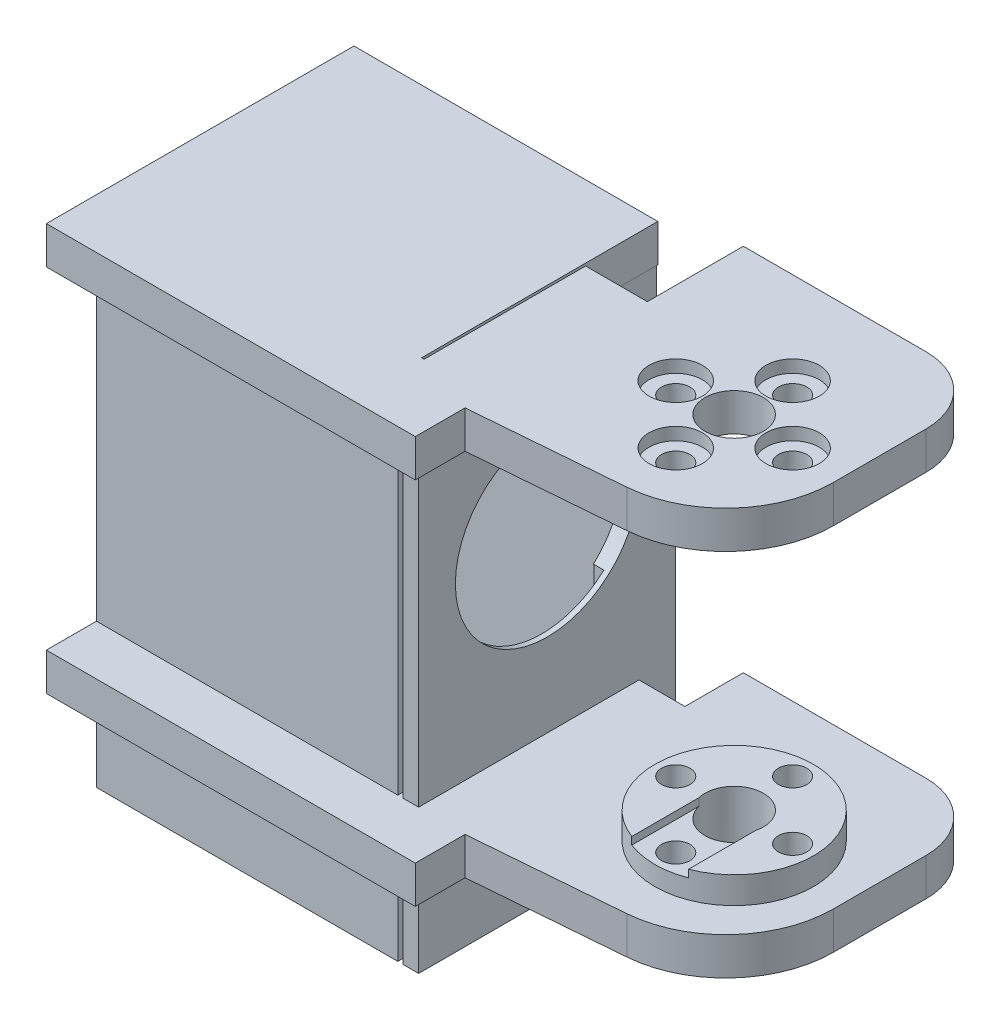
from build123d import *

# Parameters (mm, degrees)
BOSS_1_DEPTH    = 4.5
S_CYL2_R        = 9.5
BOSS_2_DEPTH    = 3.2
BOSS_3_DEPTH    = 4.5
S_PRISM4_W      = 7.5
S_PRISM4_H      = 21.95
BOSS_4_DEPTH    = 4.5
S_PRISM5_W      = 44.2
S_PRISM5_H      = 8.55
BOSS_5_DEPTH    = 4.5
S_PRISM6_W      = 36.4
S_PRISM6_H      = 30.9
BOSS_6_DEPTH    = 4.5
S_PRISM7_W      = 7.5
S_PRISM7_H      = 26.45
BOSS_7_DEPTH    = 4.5
S_PRISM8_W      = 44.2
S_PRISM8_H      = 8.55
BOSS_8_DEPTH    = 4.5
S_BOX9_W        = 36.1
S_BOX9_H        = 2.5
BOSS_9_DEPTH    = 30.8
S_BOX10_W       = 36.1
S_BOX10_H       = 51.4
BOSS_10_DEPTH   = 2.5
S_BOX11_W       = 36.1
S_BOX11_H       = 51.4
BOSS_11_DEPTH   = 2.5
S_BOX12_W       = 4.6
S_BOX12_H       = 51.4
BOSS_12_DEPTH   = 30.8
S_BOX13_W       = 1.9
S_BOX13_H       = 54.1
BOSS_13_DEPTH   = 30.8
S_BOX14_W       = 36.26
S_BOX14_H       = 6
BOSS_14_DEPTH   = 30.76
S_HOLE15_R      = 3.5
HOLE_15_DEPTH   = 4.7
S_HOLE16_R      = 1.7
HOLE_16_DEPTH   = 4.7
S_HOLE17_R      = 1.7
HOLE_17_DEPTH   = 4.7
S_HOLE18_R      = 1.7
HOLE_18_DEPTH   = 4.7
S_HOLE19_R      = 1.7
HOLE_19_DEPTH   = 4.7
S_HOLE20_R      = 3.2
HOLE_20_DEPTH   = 1.6
S_HOLE21_R      = 3.2
HOLE_21_DEPTH   = 1.6
S_HOLE22_R      = 3.2
HOLE_22_DEPTH   = 1.6
S_HOLE23_R      = 3.2
HOLE_23_DEPTH   = 1.6
S_HOLE24_R      = 3.5
HOLE_24_DEPTH   = 7.9
S_HOLE25_R      = 1.7
HOLE_25_DEPTH   = 7.9
S_HOLE26_R      = 1.7
HOLE_26_DEPTH   = 7.9
S_HOLE27_R      = 1.7
HOLE_27_DEPTH   = 7.9
S_HOLE28_R      = 1.7
HOLE_28_DEPTH   = 7.9
S_HOLE29_R      = 3.2
HOLE_29_DEPTH   = 2.1
S_HOLE30_R      = 3.2
HOLE_30_DEPTH   = 2.1
S_HOLE31_R      = 3.2
HOLE_31_DEPTH   = 2.1
S_HOLE32_R      = 3.2
HOLE_32_DEPTH   = 2.1
S_CUT33_W       = 6.8
S_CUT33_H       = 1
POCKET_33_DEPTH = 10
S_HOLE34_R      = 10.5
HOLE_34_DEPTH   = 4.8
S_CUT35_W       = 4.75
S_CUT35_H       = 19.5
POCKET_35_DEPTH = 19.4
S_CUT36_W       = 4.75
S_CUT36_H       = 8.3
POCKET_36_DEPTH = 19.4
S_CUT37_W       = 4.75
S_CUT37_H       = 11
POCKET_37_DEPTH = 7
S_CUT38_W       = 2.9
S_CUT38_H       = 20
POCKET_38_DEPTH = 15.9
S_HOLE39_R      = 1.1
HOLE_39_DEPTH   = 4.8
S_HOLE40_R      = 2.3
HOLE_40_DEPTH   = 1.7
S_HOLE41_R      = 1.1
HOLE_41_DEPTH   = 4.8
S_HOLE42_R      = 2.3
HOLE_42_DEPTH   = 1.7
S_HOLE43_R      = 1.1
HOLE_43_DEPTH   = 4.8
S_HOLE44_R      = 2.3
HOLE_44_DEPTH   = 1.7
S_HOLE45_R      = 11
HOLE_45_DEPTH   = 2.7
S_CUT46_W       = 1.85
S_CUT46_H       = 30.6
POCKET_46_DEPTH = 15
CUT_47_DEPTH    = 36.3


with BuildPart() as part:
    # S_prism1 → Boss_1 (new body)
    with BuildSketch(Plane(origin=(0, 18.8, 0), x_dir=(1, 0, 0), z_dir=(0, 1, 0))):
        with BuildLine():
            Line((13, 10), (13, -1.1138))
            ThreePointArc((13, -1.1138), (9.586829994, -9.855067448), (1.1535, -13.9707))
            Line((1.1535, -13.9707), (-16.9, -15.45))
            Line((-16.9, -15.45), (-16.9, 18))
            Line((-16.9, 18), (5, 18))
            ThreePointArc((5, 18), (10.6569, 15.6569), (13, 10))
        make_face()
    extrude(amount=BOSS_1_DEPTH)

    # S_prism4 → Boss_4 (add)
    with BuildSketch(Plane(origin=(0, 18.8, 0), x_dir=(1, 0, 0), z_dir=(0, 1, 0))):
        with Locations((-20.55, -4.475)):
            Rectangle(S_PRISM4_W, S_PRISM4_H)
    extrude(amount=BOSS_4_DEPTH)

    # S_prism5 → Boss_5 (add)
    with BuildSketch(Plane(origin=(0, 18.8, 0), x_dir=(1, 0, 0), z_dir=(0, 1, 0))):
        with Locations((-38.9, -17.125)):
            Rectangle(S_PRISM5_W, S_PRISM5_H)
    extrude(amount=BOSS_5_DEPTH)

    # S_prism6 → Boss_6 (add)
    with BuildSketch(Plane(origin=(0, 18.8, 0), x_dir=(1, 0, 0), z_dir=(0, 1, 0))):
        with Locations((-42.8, 0)):
            Rectangle(S_PRISM6_W, S_PRISM6_H)
    extrude(amount=BOSS_6_DEPTH)



with BuildPart() as body_2:
    # S_cyl2 → Boss_2 (new body)
    with BuildSketch(Plane(origin=(0, -20.95, 0), x_dir=(1, 0, 0), z_dir=(0, 1, 0))):
        with Locations(Location((0, 0, 0), (0, 0, 270))):
            Circle(S_CYL2_R)
    extrude(amount=BOSS_2_DEPTH)

    # S_prism3 → Boss_3 (add)
    with BuildSketch(Plane(origin=(0, -25.45, 0), x_dir=(1, 0, 0), z_dir=(0, 1, 0))):
        with BuildLine():
            Line((13, 10), (13, -1.1138))
            ThreePointArc((13, -1.1138), (9.586829994, -9.855067448), (1.1535, -13.9707))
            Line((1.1535, -13.9707), (-16.9, -15.45))
            Line((-16.9, -15.45), (-16.9, 18))
            Line((-16.9, 18), (5, 18))
            ThreePointArc((5, 18), (10.6569, 15.6569), (13, 10))
        make_face()
    extrude(amount=BOSS_3_DEPTH)

    # S_prism7 → Boss_7 (add)
    with BuildSketch(Plane(origin=(0, -25.45, 0), x_dir=(1, 0, 0), z_dir=(0, 1, 0))):
        with Locations((-20.55, -2.225)):
            Rectangle(S_PRISM7_W, S_PRISM7_H)
    extrude(amount=BOSS_7_DEPTH)

    # S_prism8 → Boss_8 (add)
    with BuildSketch(Plane(origin=(0, -25.45, 0), x_dir=(1, 0, 0), z_dir=(0, 1, 0))):
        with Locations((-38.9, -17.125)):
            Rectangle(S_PRISM8_W, S_PRISM8_H)
    extrude(amount=BOSS_8_DEPTH)



with BuildPart() as body_3:
    # S_box9 → Boss_9 (new body)
    with BuildSketch(Plane.XY.offset(-15.4)):
        with Locations((-42.95, 11.95)):
            Rectangle(S_BOX9_W, S_BOX9_H)
    extrude(amount=BOSS_9_DEPTH)

    # S_box10 → Boss_10 (add)
    with BuildSketch(Plane.XY.offset(-15.4)):
        with Locations((-42.95, -12.5)):
            Rectangle(S_BOX10_W, S_BOX10_H)
    extrude(amount=BOSS_10_DEPTH)


with BuildPart() as body_2_1:
    add(body_2.part)

    add(body_3.part)  # Boss_11 merges body 3
    # S_box11 → Boss_11 (add)
    with BuildSketch(Plane.XY.offset(12.9)):
        with Locations((-42.95, -12.5)):
            Rectangle(S_BOX11_W, S_BOX11_H)
    extrude(amount=BOSS_11_DEPTH)

    # S_box12 → Boss_12 (add)
    with BuildSketch(Plane.XY.offset(-15.4)):
        with Locations((-58.7, -12.5)):
            Rectangle(S_BOX12_W, S_BOX12_H)
    extrude(amount=BOSS_12_DEPTH)

    # S_box13 → Boss_13 (add)
    with BuildSketch(Plane.XY.offset(-15.4)):
        with Locations((-23.35, -11.15)):
            Rectangle(S_BOX13_W, S_BOX13_H)
    extrude(amount=BOSS_13_DEPTH)


with BuildPart() as part_1:
    add(part.part)

    add(body_2_1.part)  # Boss_14 merges body 2
    # S_box14 → Boss_14 (add)
    with BuildSketch(Plane.XY.offset(-15.38)):
        with Locations((-42.8, 15.9)):
            Rectangle(S_BOX14_W, S_BOX14_H)
    extrude(amount=BOSS_14_DEPTH)

    # S_hole15 → Hole_15 (cut)
    with BuildSketch(Plane(origin=(0, 18.7, 0), x_dir=(1, 0, 0), z_dir=(0, 1, 0))):
        with Locations(Location((0, 0, 0), (0, 0, 90))):
            Circle(S_HOLE15_R)
    extrude(amount=HOLE_15_DEPTH, mode=Mode.SUBTRACT)

    # S_hole16 → Hole_16 (cut)
    with BuildSketch(Plane(origin=(0, 18.7, 0), x_dir=(1, 0, 0), z_dir=(0, 1, 0))):
        with Locations(Location((7, 0, 0), (0, 0, 90))):
            Circle(S_HOLE16_R)
    extrude(amount=HOLE_16_DEPTH, mode=Mode.SUBTRACT)

    # S_hole17 → Hole_17 (cut)
    with BuildSketch(Plane(origin=(0, 18.7, 0), x_dir=(1, 0, 0), z_dir=(0, 1, 0))):
        with Locations(Location((0, -7, 0), (0, 0, 90))):
            Circle(S_HOLE17_R)
    extrude(amount=HOLE_17_DEPTH, mode=Mode.SUBTRACT)

    # S_hole18 → Hole_18 (cut)
    with BuildSketch(Plane(origin=(0, 18.7, 0), x_dir=(1, 0, 0), z_dir=(0, 1, 0))):
        with Locations(Location((-7, 0, 0), (0, 0, 90))):
            Circle(S_HOLE18_R)
    extrude(amount=HOLE_18_DEPTH, mode=Mode.SUBTRACT)

    # S_hole19 → Hole_19 (cut)
    with BuildSketch(Plane(origin=(0, 18.7, 0), x_dir=(1, 0, 0), z_dir=(0, 1, 0))):
        with Locations(Location((0, 7, 0), (0, 0, 90))):
            Circle(S_HOLE19_R)
    extrude(amount=HOLE_19_DEPTH, mode=Mode.SUBTRACT)

    # S_hole20 → Hole_20 (cut)
    with BuildSketch(Plane(origin=(0, 21.8, 0), x_dir=(1, 0, 0), z_dir=(0, 1, 0))):
        with Locations(Location((7, 0, 0), (0, 0, 90))):
            Circle(S_HOLE20_R)
    extrude(amount=HOLE_20_DEPTH, mode=Mode.SUBTRACT)

    # S_hole21 → Hole_21 (cut)
    with BuildSketch(Plane(origin=(0, 21.8, 0), x_dir=(1, 0, 0), z_dir=(0, 1, 0))):
        with Locations(Location((0, -7, 0), (0, 0, 90))):
            Circle(S_HOLE21_R)
    extrude(amount=HOLE_21_DEPTH, mode=Mode.SUBTRACT)

    # S_hole22 → Hole_22 (cut)
    with BuildSketch(Plane(origin=(0, 21.8, 0), x_dir=(1, 0, 0), z_dir=(0, 1, 0))):
        with Locations(Location((-7, 0, 0), (0, 0, 90))):
            Circle(S_HOLE22_R)
    extrude(amount=HOLE_22_DEPTH, mode=Mode.SUBTRACT)

    # S_hole23 → Hole_23 (cut)
    with BuildSketch(Plane(origin=(0, 21.8, 0), x_dir=(1, 0, 0), z_dir=(0, 1, 0))):
        with Locations(Location((0, 7, 0), (0, 0, 90))):
            Circle(S_HOLE23_R)
    extrude(amount=HOLE_23_DEPTH, mode=Mode.SUBTRACT)

    # S_hole24 → Hole_24 (cut)
    with BuildSketch(Plane(origin=(0, -25.55, 0), x_dir=(1, 0, 0), z_dir=(0, 1, 0))):
        with Locations(Location((0, 0, 0), (0, 0, 90))):
            Circle(S_HOLE24_R)
    extrude(amount=HOLE_24_DEPTH, mode=Mode.SUBTRACT)

    # S_hole25 → Hole_25 (cut)
    with BuildSketch(Plane(origin=(0, -25.55, 0), x_dir=(1, 0, 0), z_dir=(0, 1, 0))):
        with Locations(Location((7, 0, 0), (0, 0, 90))):
            Circle(S_HOLE25_R)
    extrude(amount=HOLE_25_DEPTH, mode=Mode.SUBTRACT)

    # S_hole26 → Hole_26 (cut)
    with BuildSketch(Plane(origin=(0, -25.55, 0), x_dir=(1, 0, 0), z_dir=(0, 1, 0))):
        with Locations(Location((0, -7, 0), (0, 0, 90))):
            Circle(S_HOLE26_R)
    extrude(amount=HOLE_26_DEPTH, mode=Mode.SUBTRACT)

    # S_hole27 → Hole_27 (cut)
    with BuildSketch(Plane(origin=(0, -25.55, 0), x_dir=(1, 0, 0), z_dir=(0, 1, 0))):
        with Locations(Location((-7, 0, 0), (0, 0, 90))):
            Circle(S_HOLE27_R)
    extrude(amount=HOLE_27_DEPTH, mode=Mode.SUBTRACT)

    # S_hole28 → Hole_28 (cut)
    with BuildSketch(Plane(origin=(0, -25.55, 0), x_dir=(1, 0, 0), z_dir=(0, 1, 0))):
        with Locations(Location((0, 7, 0), (0, 0, 90))):
            Circle(S_HOLE28_R)
    extrude(amount=HOLE_28_DEPTH, mode=Mode.SUBTRACT)

    # S_hole29 → Hole_29 (cut)
    with BuildSketch(Plane(origin=(0, -25.55, 0), x_dir=(1, 0, 0), z_dir=(0, 1, 0))):
        with Locations(Location((7, 0, 0), (0, 0, 90))):
            Circle(S_HOLE29_R)
    extrude(amount=HOLE_29_DEPTH, mode=Mode.SUBTRACT)

    # S_hole30 → Hole_30 (cut)
    with BuildSketch(Plane(origin=(0, -25.55, 0), x_dir=(1, 0, 0), z_dir=(0, 1, 0))):
        with Locations(Location((0, -7, 0), (0, 0, 90))):
            Circle(S_HOLE30_R)
    extrude(amount=HOLE_30_DEPTH, mode=Mode.SUBTRACT)

    # S_hole31 → Hole_31 (cut)
    with BuildSketch(Plane(origin=(0, -25.55, 0), x_dir=(1, 0, 0), z_dir=(0, 1, 0))):
        with Locations(Location((-7, 0, 0), (0, 0, 90))):
            Circle(S_HOLE31_R)
    extrude(amount=HOLE_31_DEPTH, mode=Mode.SUBTRACT)

    # S_hole32 → Hole_32 (cut)
    with BuildSketch(Plane(origin=(0, -25.55, 0), x_dir=(1, 0, 0), z_dir=(0, 1, 0))):
        with Locations(Location((0, 7, 0), (0, 0, 90))):
            Circle(S_HOLE32_R)
    extrude(amount=HOLE_32_DEPTH, mode=Mode.SUBTRACT)

    # S_cut33 → Pocket_33 (cut)
    with BuildSketch(Plane.XY):
        with Locations((0, -18.15)):
            Rectangle(S_CUT33_W, S_CUT33_H)
    extrude(amount=POCKET_33_DEPTH, mode=Mode.SUBTRACT)

    # S_hole34 → Hole_34 (cut)
    with BuildSketch(Plane(origin=(-61.1, 0, 0), x_dir=(0, 0, -1), z_dir=(1, 0, 0))):
        with Locations(Location((0, 0, 0), (0, 0, 180))):
            Circle(S_HOLE34_R)
    extrude(amount=HOLE_34_DEPTH, mode=Mode.SUBTRACT)

    # S_cut35 → Pocket_35 (cut)
    with BuildSketch(Plane.XY.offset(-9.7)):
        with Locations((-58.725, -20.65)):
            Rectangle(S_CUT35_W, S_CUT35_H)
    extrude(amount=POCKET_35_DEPTH, mode=Mode.SUBTRACT)

    # S_cut36 → Pocket_36 (cut)
    with BuildSketch(Plane.XY.offset(-9.7)):
        with Locations((-58.725, -34.55)):
            Rectangle(S_CUT36_W, S_CUT36_H)
    extrude(amount=POCKET_36_DEPTH, mode=Mode.SUBTRACT)

    # S_cut37 → Pocket_37 (cut)
    with BuildSketch(Plane.XY.offset(-3.5)):
        with Locations((-58.725, -5.5)):
            Rectangle(S_CUT37_W, S_CUT37_H)
    extrude(amount=POCKET_37_DEPTH, mode=Mode.SUBTRACT)

    # S_cut38 → Pocket_38 (cut)
    with BuildSketch(Plane.XY.offset(-15.9)):
        with Locations((-59.75, 0)):
            Rectangle(S_CUT38_W, S_CUT38_H)
    extrude(amount=POCKET_38_DEPTH, mode=Mode.SUBTRACT)

    # S_hole39 → Hole_39 (cut)
    with BuildSketch(Plane(origin=(-61.1, 0, 0), x_dir=(0, 0, -1), z_dir=(1, 0, 0))):
        with Locations(Location((-10.25, -8.3, 0), (0, 0, 180))):
            Circle(S_HOLE39_R)
    extrude(amount=HOLE_39_DEPTH, mode=Mode.SUBTRACT)

    # S_hole40 → Hole_40 (cut)
    with BuildSketch(Plane(origin=(-61.1, 0, 0), x_dir=(0, 0, -1), z_dir=(1, 0, 0))):
        with Locations((-10.25, -8.3)):
            Circle(S_HOLE40_R)
    extrude(amount=HOLE_40_DEPTH, mode=Mode.SUBTRACT)

    # S_hole41 → Hole_41 (cut)
    with BuildSketch(Plane(origin=(-61.1, 0, 0), x_dir=(0, 0, -1), z_dir=(1, 0, 0))):
        with Locations((10.25, -32.75)):
            Circle(S_HOLE41_R)
    extrude(amount=HOLE_41_DEPTH, mode=Mode.SUBTRACT)

    # S_hole42 → Hole_42 (cut)
    with BuildSketch(Plane(origin=(-61.1, 0, 0), x_dir=(0, 0, -1), z_dir=(1, 0, 0))):
        with Locations((10.25, -32.75)):
            Circle(S_HOLE42_R)
    extrude(amount=HOLE_42_DEPTH, mode=Mode.SUBTRACT)

    # S_hole43 → Hole_43 (cut)
    with BuildSketch(Plane(origin=(-61.1, 0, 0), x_dir=(0, 0, -1), z_dir=(1, 0, 0))):
        with Locations((-10.25, -32.75)):
            Circle(S_HOLE43_R)
    extrude(amount=HOLE_43_DEPTH, mode=Mode.SUBTRACT)

    # S_hole44 → Hole_44 (cut)
    with BuildSketch(Plane(origin=(-61.1, 0, 0), x_dir=(0, 0, -1), z_dir=(1, 0, 0))):
        with Locations((-10.25, -32.75)):
            Circle(S_HOLE44_R)
    extrude(amount=HOLE_44_DEPTH, mode=Mode.SUBTRACT)

    # S_hole45 → Hole_45 (cut)
    with BuildSketch(Plane(origin=(-25, 0, 0), x_dir=(0, 0, -1), z_dir=(1, 0, 0))):
        with Locations(Location((0, 0, 0), (0, 0, 180))):
            Circle(S_HOLE45_R)
    extrude(amount=HOLE_45_DEPTH, mode=Mode.SUBTRACT)

    # S_cut46 → Pocket_46 (cut)
    with BuildSketch(Plane.XY.offset(-7.5)):
        with Locations((-23.975, -23.4)):
            Rectangle(S_CUT46_W, S_CUT46_H)
    extrude(amount=POCKET_46_DEPTH, mode=Mode.SUBTRACT)

    # S_pcut47 → Cut_47 (cut)
    with BuildSketch(Plane(origin=(-61.1, 0, 0), x_dir=(0, 0, -1), z_dir=(1, 0, 0))):
        Polygon((16, -38.8), (16, -28.6), (5.8, -38.8), align=None)
    extrude(amount=CUT_47_DEPTH, mode=Mode.SUBTRACT)


solid = part_1.part
